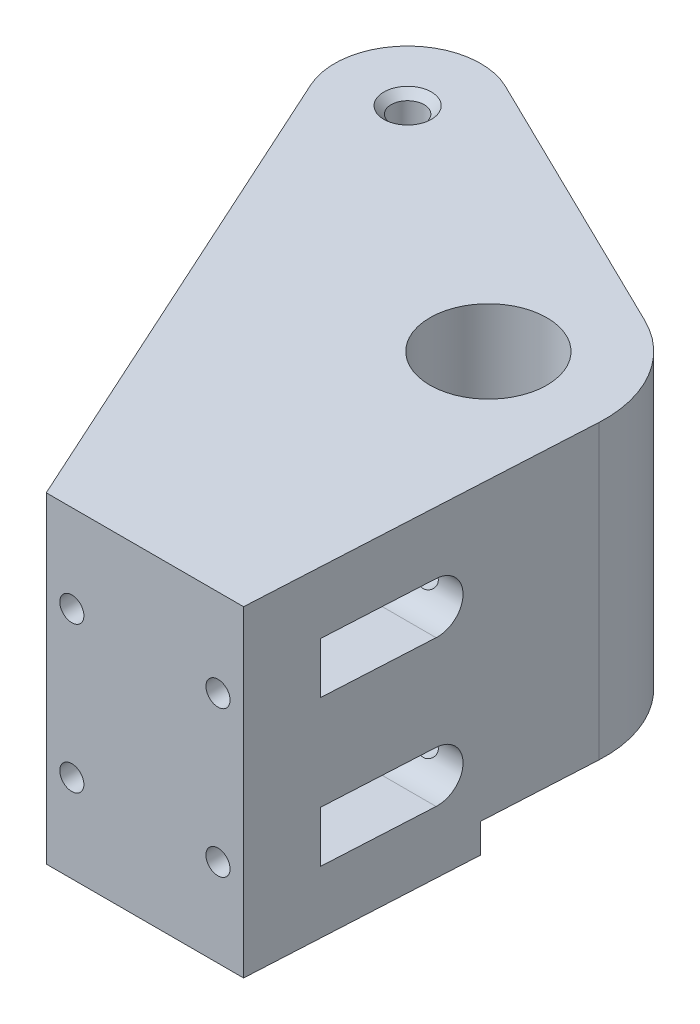
from build123d import *

# Parameters (mm, degrees)
SKETCH1_R                      = 8
SKETCH1_R_2                    = 2.25
BOSS_EXTRUDE1_DEPTH            = 44
CUT_EXTRUDE4_DEPTH             = 4
CUT_EXTRUDE5_DEPTH             = 103.107700493
F_4_5_4_5_DIAMETER_HOLE1_D     = 4.5
F_4_5_4_5_DIAMETER_HOLE1_DEPTH = 10
F_4_5_4_5_DIAMETER_HOLE1_TIP   = 1.351936393
CHAMFER1_SIZE                  = 1
F_3_3_3_3_DIAMETER_HOLE1_D     = 3.3
CUT_EXTRUDE6_DEPTH             = 103.107700536
CUT_EXTRUDE6_DEPTH_BACK        = 103.107700536


with BuildPart() as part:
    # Sketch1 → Boss-Extrude1 (new body)
    with BuildSketch(Plane(origin=(0, 0, 0), x_dir=(1, 0, 0), z_dir=(0, 1, 0))):
        with BuildLine():
            Line((-13.5, 0), (13.5, 0))
            Line((13.5, 0), (15.976995957, 46.142328626))
            ThreePointArc((15.976995957, 46.142328626), (13.793369664, 55.108202842), (7.021555451, 61.376987134))
            Line((7.021555451, 61.376987134), (-30.261527843, 79.585616959))
            ThreePointArc((-30.261527843, 79.585616959), (-41.624453455, 77.76637977), (-43.75141009, 66.457013833))
            Line((-43.75141009, 66.457013833), (-13.5, 0))
        make_face()
        with Locations(Location((0, 47, 0), (0, 0, 270))):
            Circle(SKETCH1_R, mode=Mode.SUBTRACT)
        with Locations(Location((-34.65, 70.6, 0), (0, 0, 270))):
            Circle(SKETCH1_R_2, mode=Mode.SUBTRACT)
    extrude(amount=BOSS_EXTRUDE1_DEPTH)

    # Sketch2 → Cut-Extrude4 (cut)
    with BuildSketch(Plane.XZ):
        Polygon((0, -30.75), (15.150710485, -30.75), (16.545133066, -56.725781169), (-44.65, -86.612781563), (-44.65, -30.75), align=None)
    extrude(amount=-CUT_EXTRUDE4_DEPTH, mode=Mode.SUBTRACT)

    # Sketch4 → Cut-Extrude5 (cut, through all)
    with BuildSketch(Plane.XY):
        Polygon((-16, 0), (-44.65, 37), (-44.65, 0), align=None)
    extrude(amount=-CUT_EXTRUDE5_DEPTH, mode=Mode.SUBTRACT)

    # Ø4.5 (4.5) Diameter Hole1
    with Locations(Plane(origin=(0, 4, 0), x_dir=(-1, 0, 0), z_dir=(0, -1, 0))):
        with Locations((0, 35), (0, 59), (12, 47), (-12, 47)):
            Hole(F_4_5_4_5_DIAMETER_HOLE1_D / 2, depth=F_4_5_4_5_DIAMETER_HOLE1_DEPTH)
            with Locations((0, 0, -(F_4_5_4_5_DIAMETER_HOLE1_DEPTH + F_4_5_4_5_DIAMETER_HOLE1_TIP / 2))):  # 118° drill point
                Cone(0, F_4_5_4_5_DIAMETER_HOLE1_D / 2, F_4_5_4_5_DIAMETER_HOLE1_TIP, mode=Mode.SUBTRACT)

    # Chamfer1
    chamfer1_edges = [part.edges().sort_by_distance(p)[0] for p in [
        (9.75, 4, -47),
        (-14.25, 4, -47),
        (-2.25, 4, -59),
        (-2.25, 4, -35),
        (-34.65, 44, -72.85),
    ]]
    chamfer(chamfer1_edges, length=CHAMFER1_SIZE)

    # Ø3.3 (3.3) Diameter Hole1 (through all)
    with Locations(Plane.XY):
        with Locations((-10, 32), (10, 32), (10, 12), (-10, 12)):
            Hole(F_3_3_3_3_DIAMETER_HOLE1_D / 2)

    # Sketch13 → Cut-Extrude6 (cut, two sides: drawn at the far end of the back side and taken through both)
    with BuildSketch(Plane(origin=(0, 0, 0), x_dir=(0, 0, -1), z_dir=(1, 0, 0)).offset(-CUT_EXTRUDE6_DEPTH_BACK)):
        with BuildLine():
            Line((10, 35.5), (25, 35.5))
            ThreePointArc((25, 35.5), (28.5, 32), (25, 28.5))
            Line((25, 28.5), (10, 28.5))
            Line((10, 28.5), (10, 35.5))
        make_face()
        with BuildLine():
            Line((10, 15.5), (25, 15.5))
            ThreePointArc((25, 15.5), (28.5, 12), (25, 8.5))
            Line((25, 8.5), (10, 8.5))
            Line((10, 8.5), (10, 15.5))
        make_face()
    extrude(amount=CUT_EXTRUDE6_DEPTH + CUT_EXTRUDE6_DEPTH_BACK, mode=Mode.SUBTRACT)


solid = part.part
